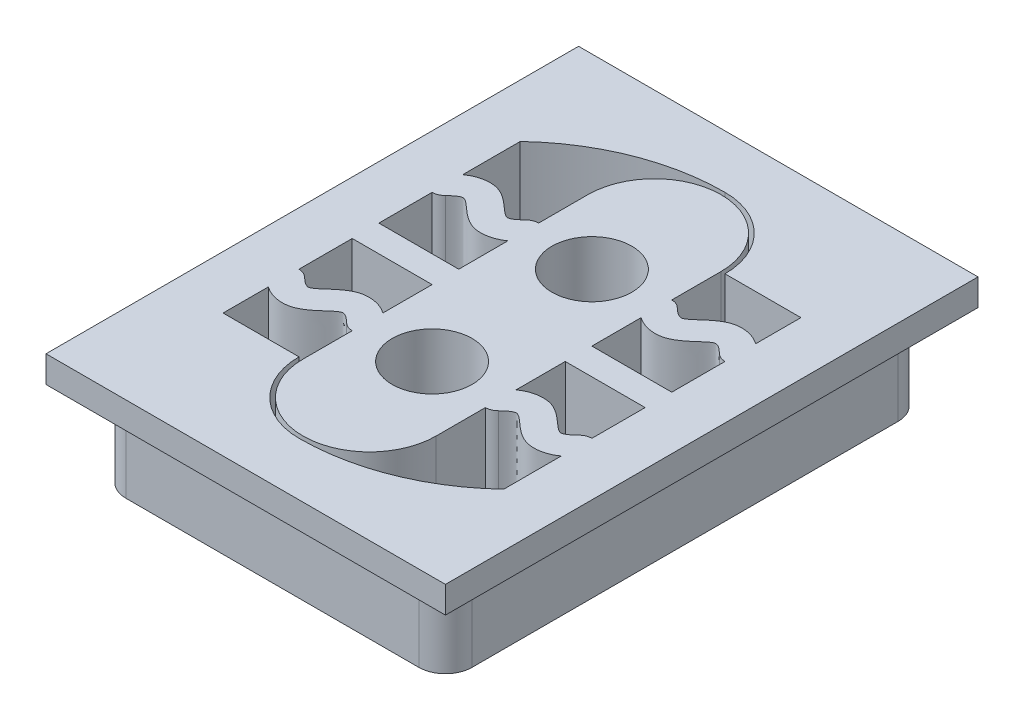
from build123d import *

# Parameters (mm, degrees)
SKETCH1_W           = 13
SKETCH1_H           = 18
BOSS_EXTRUDE1_DEPTH = 3.2
SKETCH2_W           = 15
SKETCH2_H           = 20
BOSS_EXTRUDE2_DEPTH = 1
SKETCH4_R           = 1.5
CUT_EXTRUDE2_DEPTH  = 10
FILLET1_R           = 1


with BuildPart() as part:
    # Sketch1 → Boss-Extrude1 (new body)
    with BuildSketch(Plane(origin=(0, 0, 0), x_dir=(1, 0, 0), z_dir=(0, 1, 0))):
        Rectangle(SKETCH1_W, SKETCH1_H)
    extrude(amount=BOSS_EXTRUDE1_DEPTH)

    # Sketch2 → Boss-Extrude2 (add)
    with BuildSketch(Plane(origin=(0, 3.2, 0), x_dir=(1, 0, 0), z_dir=(0, 1, 0))):
        Rectangle(SKETCH2_W, SKETCH2_H)
    extrude(amount=BOSS_EXTRUDE2_DEPTH)

    # Sketch4 → Cut-Extrude2 (cut)
    with BuildSketch(Plane.XZ):
        with Locations(Location((0, 3, 0), (0, 0, 270))):
            Circle(SKETCH4_R)
        with Locations(Location((0, -3, 0), (0, 0, 270))):
            Circle(SKETCH4_R)
        with BuildLine():
            ThreePointArc((0, 8), (-1.87383297, 7.22383297), (-2.65, 5.35))
            Line((-2.65, 5.35), (-5.5, 5.35))
            Line((-5.5, 5.35), (-5.5, 3.651406842))
            add(Edge.make_bspline(
                [(-5.5, 3.651406842), (-5.406598186, 3.716096448), (-5.101794731, 3.887751724), (-4.503330165, 3.949879095), (-3.984278911, 3.661658876), (-3.655115116, 3.35997064), (-3.393346141, 3.1328127), (-3.28033535, 3.09163995), (-3.247918098, 3.090303884), (-3.18406338, 3.104314594), (-3.06117869, 3.166784448), (-2.912518243, 3.294949286), (-2.852476749, 3.354626764)],
                knots=[0.070231934, 0.070231934, 0.070231934, 0.070231934, 0.125, 0.25, 0.375, 0.5, 0.625, 0.75, 0.8125, 0.875, 0.9375, 1, 1, 1, 1], degree=3))
            ThreePointArc((-2.852476749, 3.354626764), (-2.690639212, 3.462230128), (-2.5, 3.5))
            Line((-2.5, 3.5), (-2.5, 5.35))
            ThreePointArc((-2.5, 5.35), (0, 7.85), (2.5, 5.35))
            Line((2.5, 5.35), (2.5, 3.5))
            ThreePointArc((2.5, 3.5), (2.690639212, 3.462230128), (2.852476749, 3.354626764))
            add(Edge.make_bspline(
                [(5.5, 3.651406842), (5.406598186, 3.716096448), (5.101794731, 3.887751724), (4.503330165, 3.949879095), (3.984278911, 3.661658876), (3.655115116, 3.35997064), (3.393346141, 3.1328127), (3.28033535, 3.09163995), (3.247918098, 3.090303884), (3.18406338, 3.104314594), (3.06117869, 3.166784448), (2.912518243, 3.294949286), (2.852476749, 3.354626764)],
                knots=[0.070231934, 0.070231934, 0.070231934, 0.070231934, 0.125, 0.25, 0.375, 0.5, 0.625, 0.75, 0.8125, 0.875, 0.9375, 1, 1, 1, 1], degree=3))
            Line((5.5, 3.651406842), (5.5, 5.809475019))
            ThreePointArc((5.5, 5.809475019), (2.960084445, 7.4322204), (0, 8))
        make_face()
        with BuildLine():
            ThreePointArc((-5.147523251, 2.645373236), (-5.309360788, 2.537769872), (-5.5, 2.5))
            Line((-5.5, 2.5), (-5.5, 0.5))
            Line((-5.5, 0.5), (-2.5, 0.5))
            Line((-2.5, 0.5), (-2.5, 2.348593158))
            add(Edge.make_bspline(
                [(-5.147523251, 2.645373236), (-5.087481757, 2.705050714), (-4.93882131, 2.833215552), (-4.81593662, 2.895685406), (-4.752081902, 2.909696116), (-4.71966465, 2.90836005), (-4.606653859, 2.8671873), (-4.344884884, 2.64002936), (-4.015721089, 2.338341124), (-3.496669835, 2.050120905), (-2.898205269, 2.112248276), (-2.593401814, 2.283903552), (-2.5, 2.348593158)],
                knots=[0, 0, 0, 0, 0.0625, 0.125, 0.1875, 0.25, 0.375, 0.5, 0.625, 0.75, 0.875, 0.929768066, 0.929768066, 0.929768066, 0.929768066], degree=3))
        make_face()
        with BuildLine():
            Line((5.5, 0.5), (5.5, 2.5))
            ThreePointArc((5.5, 2.5), (5.309360788, 2.537769872), (5.147523251, 2.645373236))
            add(Edge.make_bspline(
                [(5.147523251, 2.645373236), (5.087481757, 2.705050714), (4.93882131, 2.833215552), (4.81593662, 2.895685406), (4.752081902, 2.909696116), (4.71966465, 2.90836005), (4.606653859, 2.8671873), (4.344884884, 2.64002936), (4.015721089, 2.338341124), (3.496669835, 2.050120905), (2.898205269, 2.112248276), (2.593401814, 2.283903552), (2.5, 2.348593158)],
                knots=[0, 0, 0, 0, 0.0625, 0.125, 0.1875, 0.25, 0.375, 0.5, 0.625, 0.75, 0.875, 0.929768066, 0.929768066, 0.929768066, 0.929768066], degree=3))
            Line((2.5, 2.348593158), (2.5, 0.5))
            Line((2.5, 0.5), (5.5, 0.5))
        make_face()
        with BuildLine():
            Line((-2.5, -0.5), (-5.5, -0.5))
            Line((-5.5, -0.5), (-5.5, -2.5))
            ThreePointArc((-5.5, -2.5), (-5.309360788, -2.537769872), (-5.147523251, -2.645373236))
            add(Edge.make_bspline(
                [(-5.147523251, -2.645373236), (-5.087481757, -2.705050714), (-4.93882131, -2.833215552), (-4.81593662, -2.895685406), (-4.752081902, -2.909696116), (-4.71966465, -2.90836005), (-4.606653859, -2.8671873), (-4.344884884, -2.64002936), (-4.015721089, -2.338341124), (-3.496669835, -2.050120905), (-2.898205269, -2.112248276), (-2.593401814, -2.283903552), (-2.5, -2.348593158)],
                knots=[0, 0, 0, 0, 0.0625, 0.125, 0.1875, 0.25, 0.375, 0.5, 0.625, 0.75, 0.875, 0.929768066, 0.929768066, 0.929768066, 0.929768066], degree=3))
            Line((-2.5, -2.348593158), (-2.5, -0.5))
        make_face()
        with BuildLine():
            Line((5.5, -2.5), (5.5, -0.5))
            Line((5.5, -0.5), (2.5, -0.5))
            Line((2.5, -0.5), (2.5, -2.348593158))
            add(Edge.make_bspline(
                [(5.147523251, -2.645373236), (5.087481757, -2.705050714), (4.93882131, -2.833215552), (4.81593662, -2.895685406), (4.752081902, -2.909696116), (4.71966465, -2.90836005), (4.606653859, -2.8671873), (4.344884884, -2.64002936), (4.015721089, -2.338341124), (3.496669835, -2.050120905), (2.898205269, -2.112248276), (2.593401814, -2.283903552), (2.5, -2.348593158)],
                knots=[0, 0, 0, 0, 0.0625, 0.125, 0.1875, 0.25, 0.375, 0.5, 0.625, 0.75, 0.875, 0.929768066, 0.929768066, 0.929768066, 0.929768066], degree=3))
            ThreePointArc((5.147523251, -2.645373236), (5.309360788, -2.537769872), (5.5, -2.5))
        make_face()
        with BuildLine():
            add(Edge.make_bspline(
                [(-5.5, -3.651406842), (-5.406598186, -3.716096448), (-5.101794731, -3.887751724), (-4.503330165, -3.949879095), (-3.984278911, -3.661658876), (-3.655115116, -3.35997064), (-3.393346141, -3.1328127), (-3.28033535, -3.09163995), (-3.247918098, -3.090303884), (-3.18406338, -3.104314594), (-3.06117869, -3.166784448), (-2.912518243, -3.294949286), (-2.852476749, -3.354626764)],
                knots=[0.070231934, 0.070231934, 0.070231934, 0.070231934, 0.125, 0.25, 0.375, 0.5, 0.625, 0.75, 0.8125, 0.875, 0.9375, 1, 1, 1, 1], degree=3))
            Line((-5.5, -3.651406842), (-5.5, -5.809475019))
            ThreePointArc((-5.5, -5.809475019), (-2.960084445, -7.4322204), (0, -8))
            ThreePointArc((0, -8), (1.87383297, -7.22383297), (2.65, -5.35))
            Line((2.65, -5.35), (5.5, -5.35))
            Line((5.5, -5.35), (5.5, -3.651406842))
            add(Edge.make_bspline(
                [(5.5, -3.651406842), (5.406598186, -3.716096448), (5.101794731, -3.887751724), (4.503330165, -3.949879095), (3.984278911, -3.661658876), (3.655115116, -3.35997064), (3.393346141, -3.1328127), (3.28033535, -3.09163995), (3.247918098, -3.090303884), (3.18406338, -3.104314594), (3.06117869, -3.166784448), (2.912518243, -3.294949286), (2.852476749, -3.354626764)],
                knots=[0.070231934, 0.070231934, 0.070231934, 0.070231934, 0.125, 0.25, 0.375, 0.5, 0.625, 0.75, 0.8125, 0.875, 0.9375, 1, 1, 1, 1], degree=3))
            ThreePointArc((2.852476749, -3.354626764), (2.690639212, -3.462230128), (2.5, -3.5))
            Line((2.5, -3.5), (2.5, -5.35))
            ThreePointArc((2.5, -5.35), (0, -7.85), (-2.5, -5.35))
            Line((-2.5, -5.35), (-2.5, -3.5))
            ThreePointArc((-2.5, -3.5), (-2.690639212, -3.462230128), (-2.852476749, -3.354626764))
        make_face()
    extrude(amount=-CUT_EXTRUDE2_DEPTH, mode=Mode.SUBTRACT)

    # Fillet1
    fillet1_edges = [part.edges().sort_by_distance(p)[0] for p in [
        (6.5, 1.6, 9),
        (-6.5, 1.6, 9),
        (-6.5, 1.6, -9),
        (6.5, 1.6, -9),
    ]]
    fillet(fillet1_edges, radius=FILLET1_R)


solid = part.part
